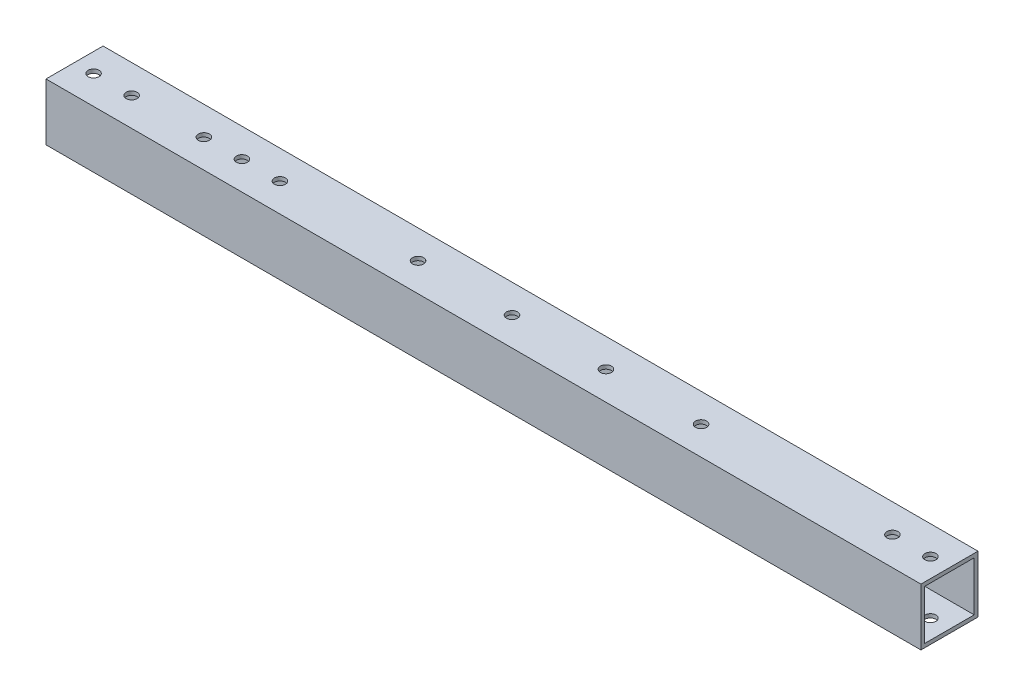
from build123d import *

# Parameters (mm, degrees)
SKETCH_1_W          = 15
SKETCH_1_H          = 15
SKETCH_1_W_2        = 13
SKETCH_1_H_2        = 13
EXTRUDE_1_DEPTH     = 230
SKETCH_2_R          = 1.45
CUT_EXTRUDE_1_DEPTH = 231.610602532


with BuildPart() as part:
    # 草图1 → 凸台-拉伸1 (new body)
    with BuildSketch(Plane(origin=(0, 0, 0), x_dir=(0, 0, -1), z_dir=(1, 0, 0))):
        Rectangle(SKETCH_1_W, SKETCH_1_H)
        Rectangle(SKETCH_1_W_2, SKETCH_1_H_2, mode=Mode.SUBTRACT)
    extrude(amount=EXTRUDE_1_DEPTH)

    # 草图2 → 切除-拉伸1 (cut, through all)
    with BuildSketch(Plane.XZ.offset(7.5)):
        with Locations(Location((215, 0, 0), (0, 0, 270))):
            Circle(SKETCH_2_R)
        with Locations(Location((225, 0, 0), (0, 0, 270))):
            Circle(SKETCH_2_R)
        with Locations(Location((164.69848481, 0, 0), (0, 0, 270))):
            Circle(SKETCH_2_R)
        with Locations(Location((139.69848481, 0, 0), (0, 0, 270))):
            Circle(SKETCH_2_R)
        with Locations(Location((5, 0, 0), (0, 0, 270))):
            Circle(SKETCH_2_R)
        with Locations(Location((15, 0, 0), (0, 0, 270))):
            Circle(SKETCH_2_R)
        with Locations(Location((115, 0, 0), (0, 0, 270))):
            Circle(SKETCH_2_R)
        with Locations(Location((90.3, 0, 0), (0, 0, 270))):
            Circle(SKETCH_2_R)
        with Locations(Location((34, 0, 0), (0, 0, 270))):
            Circle(SKETCH_2_R)
        with Locations(Location((44, 0, 0), (0, 0, 270))):
            Circle(SKETCH_2_R)
        with Locations(Location((54, 0, 0), (0, 0, 270))):
            Circle(SKETCH_2_R)
    extrude(amount=-CUT_EXTRUDE_1_DEPTH, mode=Mode.SUBTRACT)


solid = part.part
